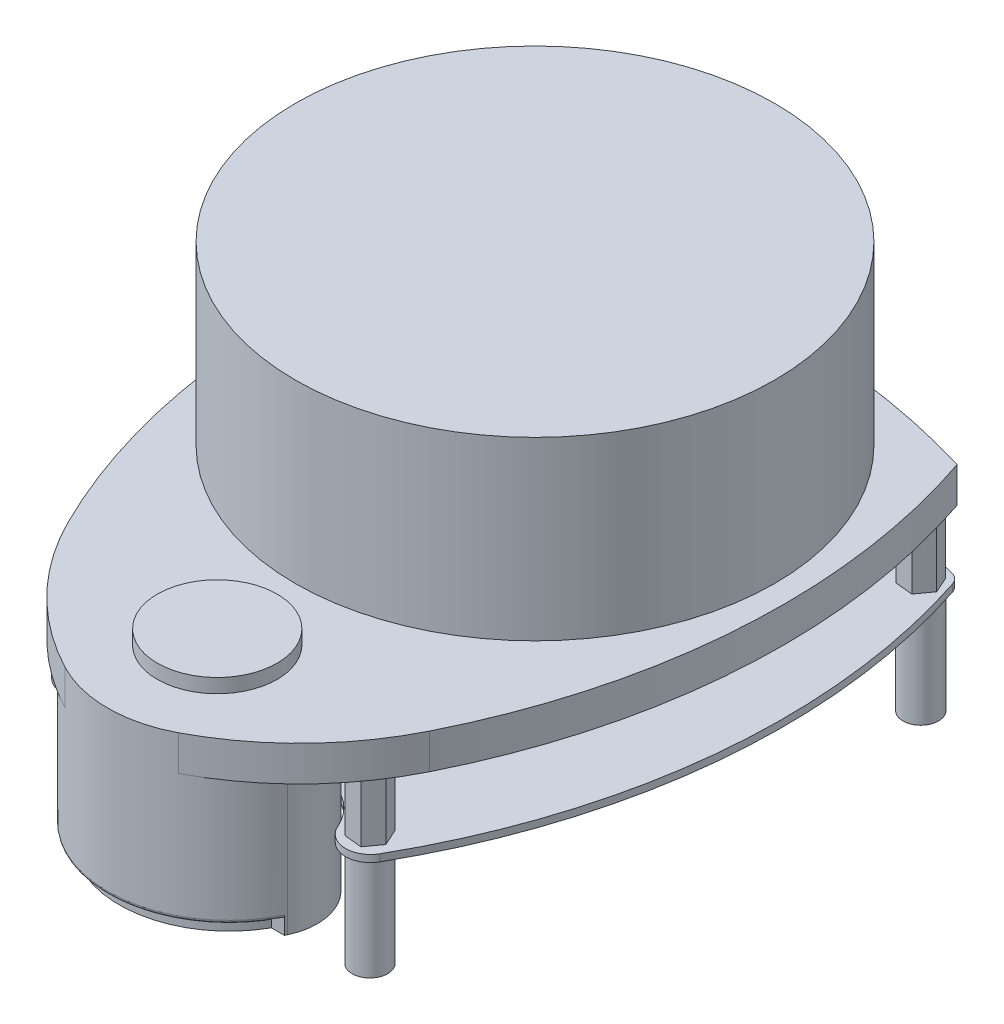
from build123d import *

# Parameters (mm, degrees)
SKETCH_1_R          = 2.525444103
SKETCH_1_R_2        = 1.206738485
EXTRUDE_1_DEPTH     = 15
EXTRUDE_1_2_DEPTH   = 15
EXTRUDE_1_3_DEPTH   = 15
EXTRUDE_1_4_DEPTH   = 15
EXTRUDE_2_DEPTH     = 1
SKETCH_3_R          = 1.206738485
EXTRUDE_3_DEPTH     = 9
EXTRUDE_4_DEPTH     = 5
EXTRUDE_START       = 20
EXTRUDE_5_DEPTH     = 20
CUT_EXTRUDE_1_DEPTH = 2
FILLET_1_R          = 0.5
SKETCH_7_R          = 14.601754061
SKETCH_7_R_2        = 8.492985931
EXTRUDE_6_DEPTH     = 2
SKETCH_8_R          = 34
EXTRUDE_7_DEPTH     = 25


with BuildPart() as part:
    # 草图1 → 凸台-拉伸1 (new body)
    with BuildSketch(Plane(origin=(0, 0, 0), x_dir=(1, 0, 0), z_dir=(0, 1, 0))):
        with Locations(Location((-28.387774848, 41.175361777, 0), (0, 0, 270))):
            Circle(SKETCH_1_R)
        with Locations(Location((-28.387774848, 41.175361777, 0), (0, 0, 270))):
            Circle(SKETCH_1_R_2, mode=Mode.SUBTRACT)
    extrude(amount=EXTRUDE_1_DEPTH)



with BuildPart() as body_2:
    # 草图1 → Extrude 1 2 (new body)
    with BuildSketch(Plane(origin=(0, 0, 0), x_dir=(1, 0, 0), z_dir=(0, 1, 0))):
        with Locations(Location((27.718646552, 41.175361777, 0), (0, 0, 270))):
            Circle(SKETCH_1_R)
        with Locations(Location((27.718646552, 41.175361777, 0), (0, 0, 270))):
            Circle(SKETCH_1_R_2, mode=Mode.SUBTRACT)
    extrude(amount=EXTRUDE_1_2_DEPTH)


with BuildPart() as body_3:
    # 草图1 → Extrude 1 3 (new body)
    with BuildSketch(Plane(origin=(0, 0, 0), x_dir=(1, 0, 0), z_dir=(0, 1, 0))):
        with Locations(Location((19.695499635, -28.946408229, 0), (0, 0, 270))):
            Circle(SKETCH_1_R)
        with Locations(Location((19.695499635, -28.946408229, 0), (0, 0, 270))):
            Circle(SKETCH_1_R_2, mode=Mode.SUBTRACT)
    extrude(amount=EXTRUDE_1_3_DEPTH)


with BuildPart() as body_4:
    # 草图1 → Extrude 1 4 (new body)
    with BuildSketch(Plane(origin=(0, 0, 0), x_dir=(1, 0, 0), z_dir=(0, 1, 0))):
        with Locations(Location((-20.384564295, -29.006371883, 0), (0, 0, 270))):
            Circle(SKETCH_1_R)
        with Locations(Location((-20.384564295, -29.006371883, 0), (0, 0, 270))):
            Circle(SKETCH_1_R_2, mode=Mode.SUBTRACT)
    extrude(amount=EXTRUDE_1_4_DEPTH)


with BuildPart() as part_1:
    add(part.part)

    add(body_2.part)  # 凸台-拉伸2 merges body 2

    add(body_3.part)  # 凸台-拉伸2 merges body 3

    add(body_4.part)  # 凸台-拉伸2 merges body 4
    # 草图2 → 凸台-拉伸2 (add)
    with BuildSketch(Plane(origin=(0, 15, 0), x_dir=(1, 0, 0), z_dir=(0, 1, 0))):
        with BuildLine():
            ThreePointArc((-0.271405212, 48.428059813), (-15.076874658, 47.395350678), (-29.591025821, 44.295700747))
            ThreePointArc((-29.591025821, 44.295700747), (-30.425446284, 43.813362835), (-30.937389258, 42.996771284))
            ThreePointArc((-30.937389258, 42.996771284), (-35.014604001, 5.325002623), (-23.460887401, -30.7623562))
            ThreePointArc((-23.460887401, -30.7623562), (-20.186933133, -32.543063374), (-17.131754901, -30.40868277))
            ThreePointArc((-17.131754901, -30.40868277), (-15.675739537, -28.10111065), (-13.582203175, -26.351260562))
            ThreePointArc((-13.582203175, -26.351260562), (-0.271405212, -22.664793676), (13.039392752, -26.351260562))
            ThreePointArc((13.039392752, -26.351260562), (15.132929113, -28.10111065), (16.588944478, -30.40868277))
            ThreePointArc((16.588944478, -30.40868277), (19.644122709, -32.543063374), (22.918076977, -30.7623562))
            ThreePointArc((22.918076977, -30.7623562), (34.471793578, 5.325002623), (30.394578834, 42.996771284))
            ThreePointArc((30.394578834, 42.996771284), (29.88263586, 43.813362835), (29.048215398, 44.295700747))
            ThreePointArc((29.048215398, 44.295700747), (14.534064235, 47.395350678), (-0.271405212, 48.428059813))
        make_face()
    extrude(amount=EXTRUDE_2_DEPTH)

    # 草图3 → 凸台-拉伸3 (add)
    # profile 1 of 4: a face of its own
    with BuildSketch(Plane(origin=(0, 16, 0), x_dir=(1, 0, 0), z_dir=(0, 1, 0))):
        Polygon((22.207746053, -29.204256732), (21.174926198, -26.899663262), (18.66267978, -26.641814759), (17.183253217, -28.688559726), (18.216073072, -30.993153196), (20.72831949, -31.251001699), align=None)
        with Locations(Location((19.695499635, -28.946408229, 0), (0, 0, 270))):
            Circle(SKETCH_3_R, mode=Mode.SUBTRACT)
    # profile 2 of 4: a face of its own
    with BuildSketch(Plane(origin=(0, 16, 0), x_dir=(1, 0, 0), z_dir=(0, 1, 0))):
        Polygon((-18.905137732, -26.959626916), (-21.41738415, -26.701778413), (-22.896810713, -28.74852338), (-21.863990858, -31.05311685), (-19.35174444, -31.310965353), (-17.872317877, -29.264220386), align=None)
        with Locations(Location((-20.384564295, -29.006371883, 0), (0, 0, 270))):
            Circle(SKETCH_3_R, mode=Mode.SUBTRACT)
    # profile 3 of 4: a face of its own
    with BuildSketch(Plane(origin=(0, 16, 0), x_dir=(1, 0, 0), z_dir=(0, 1, 0))):
        Polygon((26.685826697, 43.479955247), (25.206400134, 41.43321028), (26.239219989, 39.12861681), (28.751466407, 38.870768307), (30.23089297, 40.917513274), (29.198073115, 43.222106744), align=None)
        with Locations(Location((27.718646552, 41.175361777, 0), (0, 0, 270))):
            Circle(SKETCH_3_R, mode=Mode.SUBTRACT)
    # profile 4 of 4: a face of its own
    with BuildSketch(Plane(origin=(0, 16, 0), x_dir=(1, 0, 0), z_dir=(0, 1, 0))):
        Polygon((-30.900021266, 41.43321028), (-29.867201411, 39.12861681), (-27.354954993, 38.870768307), (-25.87552843, 40.917513274), (-26.908348285, 43.222106744), (-29.420594703, 43.479955247), align=None)
        with Locations(Location((-28.387774848, 41.175361777, 0), (0, 0, 270))):
            Circle(SKETCH_3_R, mode=Mode.SUBTRACT)
    extrude(amount=EXTRUDE_3_DEPTH)

    # 草图4 → 凸台-拉伸4 (add)
    with BuildSketch(Plane(origin=(0, 25, 0), x_dir=(1, 0, 0), z_dir=(0, 1, 0))):
        with BuildLine():
            ThreePointArc((-0.271405212, 48.428034147), (-15.594215434, 47.321055953), (-30.593831711, 44.000600361))
            ThreePointArc((-30.593831711, 44.000600361), (-35.27623055, 8.446713655), (-25.910625184, -26.169599767))
            ThreePointArc((-25.910625184, -26.169599767), (-18.523285067, -36.56455338), (-8.301229723, -44.18934447))
            ThreePointArc((-8.301229723, -44.18934447), (-0.271405212, -46.17502358), (7.758419299, -44.18934447))
            ThreePointArc((7.758419299, -44.18934447), (17.980474644, -36.56455338), (25.36781476, -26.169599767))
            ThreePointArc((25.36781476, -26.169599767), (34.733420126, 8.446713655), (30.051021288, 44.000600361))
            ThreePointArc((30.051021288, 44.000600361), (15.05140501, 47.321055953), (-0.271405212, 48.428034147))
        make_face()
    extrude(amount=EXTRUDE_4_DEPTH)

    # 草图5 → 凸台-拉伸5 (add)
    with BuildSketch(Plane.XZ.offset(-25).offset(EXTRUDE_START)):
        with BuildLine():
            ThreePointArc((15.323487668, 36.26928355), (-0.271405212, 46.17502358), (-15.866298092, 36.26928355))
            ThreePointArc((-15.866298092, 36.26928355), (-16.212731749, 30.227590505), (-12.285634009, 25.623247505))
            ThreePointArc((-12.285634009, 25.623247505), (-0.271405212, 22.664793676), (11.742823586, 25.623247505))
            ThreePointArc((11.742823586, 25.623247505), (15.669921326, 30.227590505), (15.323487668, 36.26928355))
        make_face()
    extrude(amount=-EXTRUDE_5_DEPTH)

    # 草图6 → 切除-拉伸1 (cut)
    with BuildSketch(Plane.XZ.offset(-5)):
        with BuildLine():
            Line((-15.724205973, 36.56455338), (-13.8705587, 36.56455338))
            ThreePointArc((-13.8705587, 36.56455338), (-0.271405212, 44.534003013), (13.327748276, 36.56455338))
            Line((13.327748276, 36.56455338), (15.18139555, 36.56455338))
            ThreePointArc((15.18139555, 36.56455338), (-0.271405212, 46.17502358), (-15.724205973, 36.56455338))
        make_face()
    extrude(amount=-CUT_EXTRUDE_1_DEPTH, mode=Mode.SUBTRACT)

    # 圆角1
    fillet_1_edges = [part_1.edges().sort_by_distance(p)[0] for p in [
        (-0.271405212, 7, 46.17502358),
    ]]
    fillet(fillet_1_edges, radius=FILLET_1_R)

    # 草图7 → 凸台-拉伸6 (add)
    with BuildSketch(Plane(origin=(0, 30, 0), x_dir=(1, 0, 0), z_dir=(0, 1, 0))):
        with Locations(Location((-0.271405212, 14.438151783, 0), (0, 0, 270))):
            Circle(SKETCH_7_R)
        with Locations(Location((-0.271405212, -30.637034449, 0), (0, 0, 270))):
            Circle(SKETCH_7_R_2)
    extrude(amount=EXTRUDE_6_DEPTH)

    # 草图8 → 凸台-拉伸7 (add)
    with BuildSketch(Plane(origin=(0, 32, 0), x_dir=(1, 0, 0), z_dir=(0, 1, 0))):
        with Locations(Location((-0.271405212, 14.438151783, 0), (0, 0, 270))):
            Circle(SKETCH_8_R)
    extrude(amount=EXTRUDE_7_DEPTH)


solid = part_1.part
